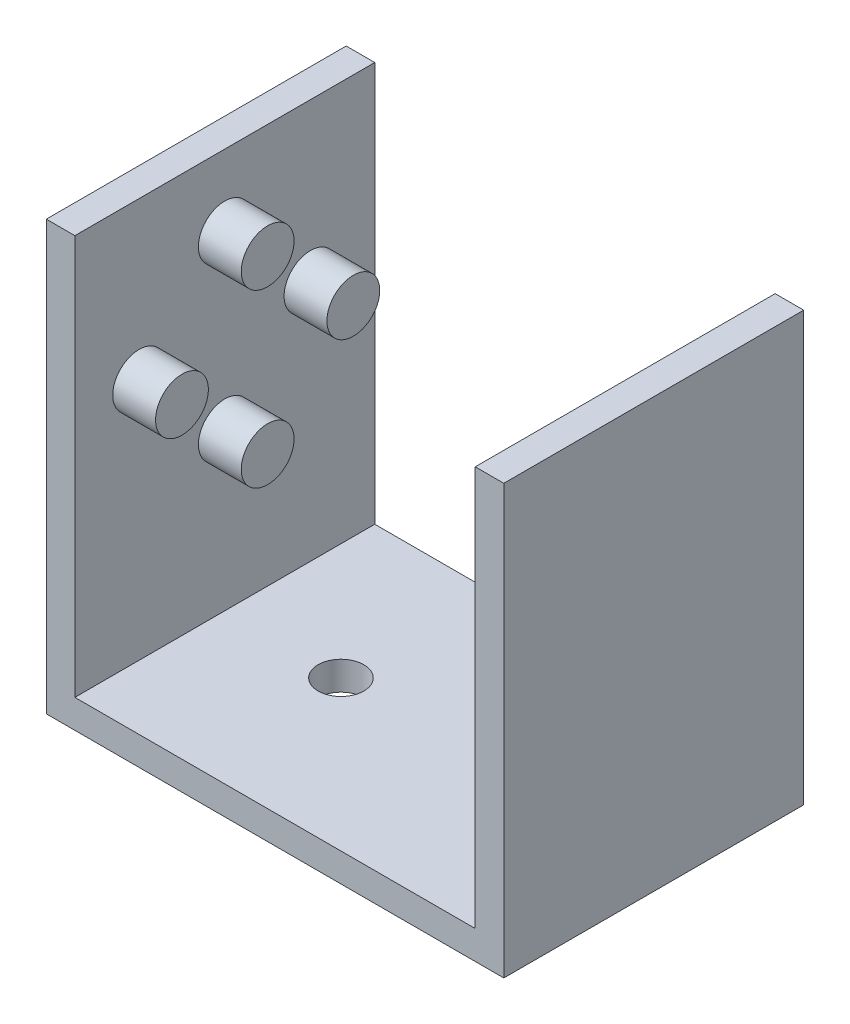
from build123d import *

# Parameters (mm, degrees)
BOSS_EXTRUDE4_DEPTH = 21
SKETCH2_R           = 1.85
BOSS_EXTRUDE5_DEPTH = 3
SKETCH3_R           = 1.85
BOSS_EXTRUDE6_DEPTH = 3
SKETCH6_R           = 1.6
CUT_EXTRUDE1_DEPTH  = 3


with BuildPart() as part:
    # Sketch1 → Boss-Extrude4 (new body)
    with BuildSketch(Plane.XY):
        Polygon((12.320696932, -8.294821565), (14.320696932, -8.294821565), (14.320696932, -38.294821565), (-17.714685402, -38.294821565), (-17.714685402, -8.294821565), (-15.714685402, -8.294821565), (-15.714685402, -36.294821565), (12.320696932, -36.294821565), align=None)
    extrude(amount=-BOSS_EXTRUDE4_DEPTH)

    # Sketch2 → Boss-Extrude5 (add)
    with BuildSketch(Plane(origin=(-15.714685402, 0, 0), x_dir=(0, 0, -1), z_dir=(1, 0, 0))):
        with Locations((10.5, -25.294821565)):
            Circle(SKETCH2_R)
        with Locations((16.5, -19.294821565)):
            Circle(SKETCH2_R)
        with Locations((4.5, -19.294821565)):
            Circle(SKETCH2_R)
        with Locations((10.5, -13.294821565)):
            Circle(SKETCH2_R)
    extrude(amount=BOSS_EXTRUDE5_DEPTH)

    # Sketch6 → Cut-Extrude1 (cut)
    with BuildSketch(Plane.XZ.offset(38.294821565)):
        with Locations(Location((7.418581263, -10.5, 0), (0, 0, 270))):
            Circle(SKETCH6_R)
        with Locations(Location((-7.581418737, -10.5, 0), (0, 0, 90))):
            Circle(SKETCH6_R)
    extrude(amount=-CUT_EXTRUDE1_DEPTH, mode=Mode.SUBTRACT)


with BuildPart() as body_2:
    # Sketch3 → Boss-Extrude6 (new body)
    with BuildSketch(Plane.ZY.offset(-12.320696932)):
        with Locations(Location((-10.5, -19.294821565, 0), (0, 0, 270))):
            Circle(SKETCH3_R)
    extrude(amount=BOSS_EXTRUDE6_DEPTH)


solid = Compound([part.part, body_2.part])
